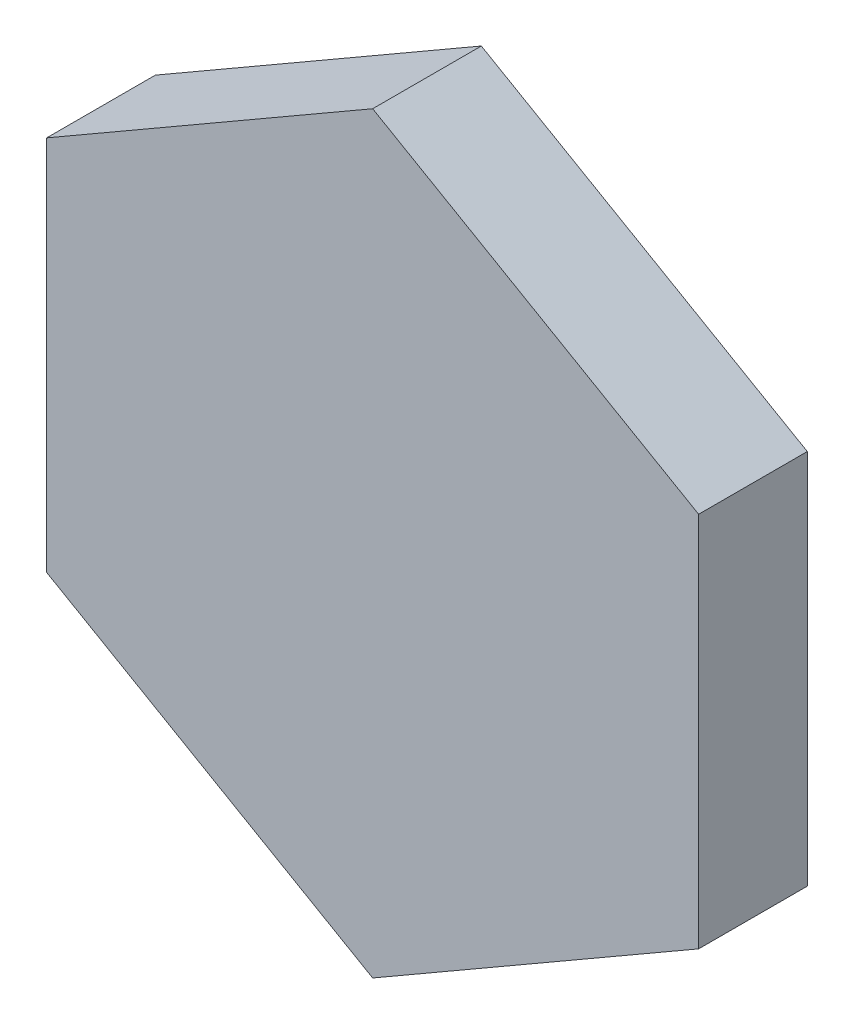
from build123d import *

# Parameters (mm, degrees)
BOSS_EXTRUDE1_DEPTH = 20


with BuildPart() as part:
    # Sketch1 → Boss-Extrude1 (new body)
    with BuildSketch(Plane.XY):
        Polygon((60, 34.641016151), (0, 69.282032303), (-60, 34.641016151), (-60, -34.641016151), (0, -69.282032303), (60, -34.641016151), align=None)
    extrude(amount=BOSS_EXTRUDE1_DEPTH)


solid = part.part
